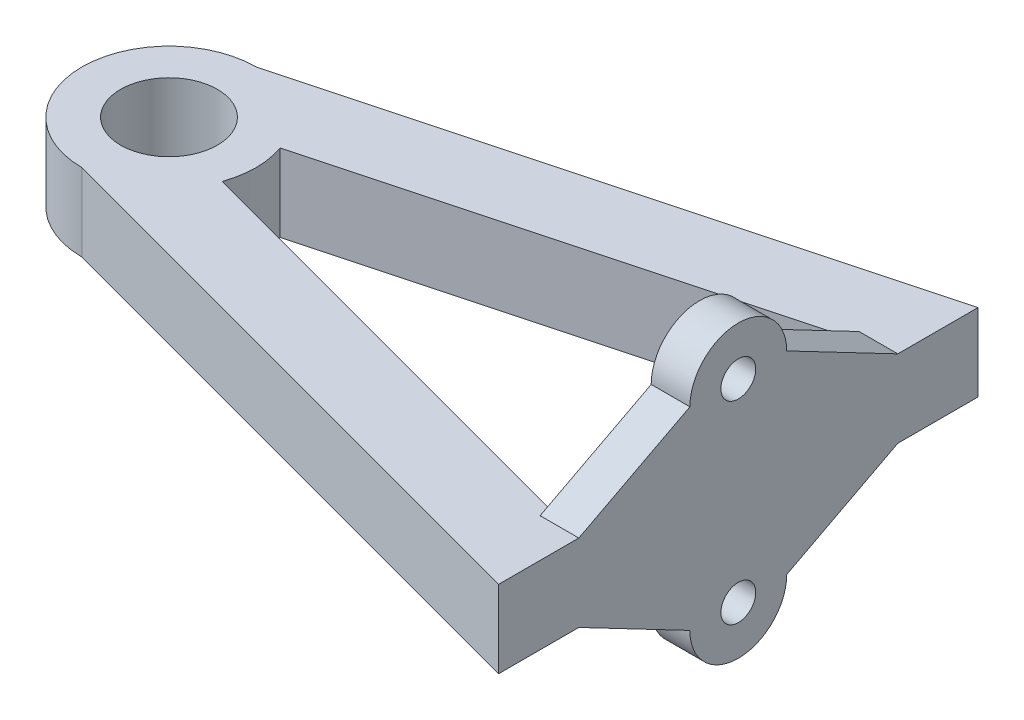
from build123d import *

# Parameters (mm, degrees)
SKETCH1_R           = 6.25
BOSS_EXTRUDE1_DEPTH = 10
SKETCH2_R           = 2.25
BOSS_EXTRUDE2_DEPTH = 5


with BuildPart() as part:
    # Sketch1 → Boss-Extrude1 (new body)
    with BuildSketch(Plane(origin=(0, 0, 0), x_dir=(1, 0, 0), z_dir=(0, 1, 0))):
        with BuildLine():
            Line((0, 11.25), (73.5, 30.944265644))
            Line((73.5, 30.944265644), (73.5, 20.59150384))
            Line((73.5, 20.59150384), (10.610062869, 3.740195973))
            ThreePointArc((10.610062869, 3.740195973), (11.25, 0), (10.610062869, -3.740195973))
            Line((10.610062869, -3.740195973), (73.5, -20.59150384))
            Line((73.5, -20.59150384), (73.5, -30.944265644))
            Line((73.5, -30.944265644), (0, -11.25))
            ThreePointArc((0, -11.25), (-11.25, 0), (0, 11.25))
        make_face()
        with Locations(Location((0, 0, 0), (0, 0, 270))):
            Circle(SKETCH1_R, mode=Mode.SUBTRACT)
    extrude(amount=BOSS_EXTRUDE1_DEPTH)

    # Sketch2 → Boss-Extrude2 (add)
    with BuildSketch(Plane(origin=(73.5, 0, 0), x_dir=(0, 0, -1), z_dir=(1, 0, 0))):
        with BuildLine():
            Line((-20.59150384, 10), (-6.25, 17.5))
            ThreePointArc((-6.25, 17.5), (0, 23.75), (6.25, 17.5))
            Line((6.25, 17.5), (20.59150384, 10))
            Line((20.59150384, 10), (20.59150384, 0))
            Line((20.59150384, 0), (6.25, -7.5))
            ThreePointArc((6.25, -7.5), (0, -13.75), (-6.25, -7.5))
            Line((-6.25, -7.5), (-20.59150384, 0))
            Line((-20.59150384, 0), (-20.59150384, 10))
        make_face()
        with Locations((0, 17.5)):
            Circle(SKETCH2_R, mode=Mode.SUBTRACT)
        with Locations((0, -7.5)):
            Circle(SKETCH2_R, mode=Mode.SUBTRACT)
    extrude(amount=-BOSS_EXTRUDE2_DEPTH)


solid = part.part
